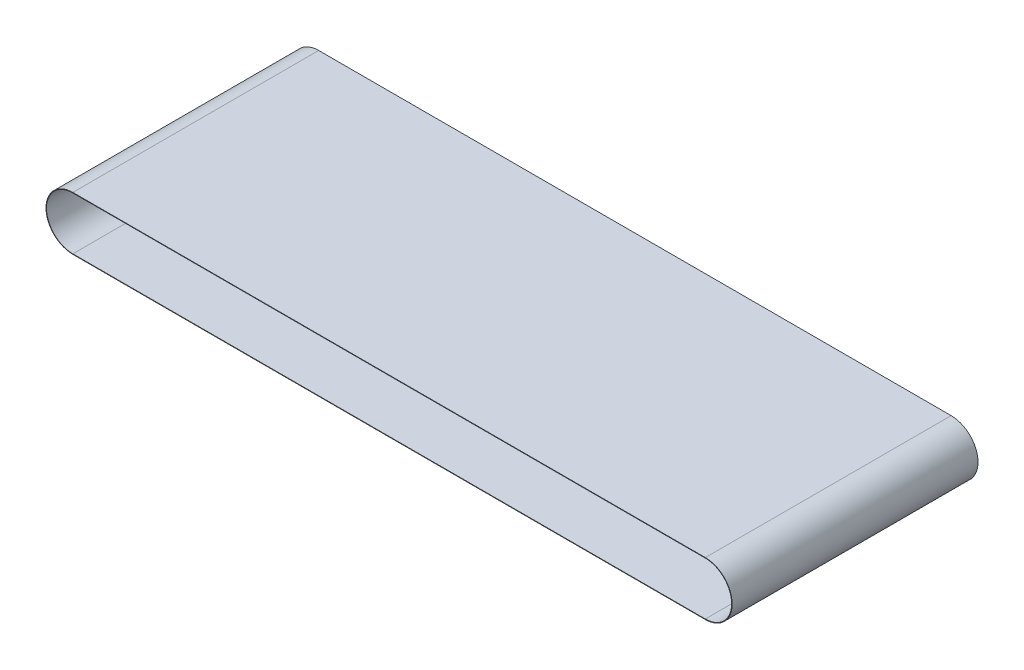
from build123d import *

# Parameters (mm, degrees)
SKETCH_4_W = 1525
SKETCH_4_H = 3


with BuildPart() as part:
    # 扫描1: sweep along a path in 草图2
    with BuildLine(Plane.XY) as sweep_1_path:
        Line((0, 165), (3923.276111442, 165))
        ThreePointArc((3923.276111442, 165), (4088.276111442, 0), (3923.276111442, -165))
        Line((3923.276111442, -165), (0, -165))
        ThreePointArc((0, -165), (-165, 0), (0, 165))
    # 草图4 → 扫描1 (sweep)
    with BuildSketch(Plane(origin=(0, 0, 0), x_dir=(0, 0, -1), z_dir=(1, 0, 0))):
        with Locations((0, 165)):
            Rectangle(SKETCH_4_W, SKETCH_4_H)
    sweep(path=sweep_1_path.line)


solid = part.part
